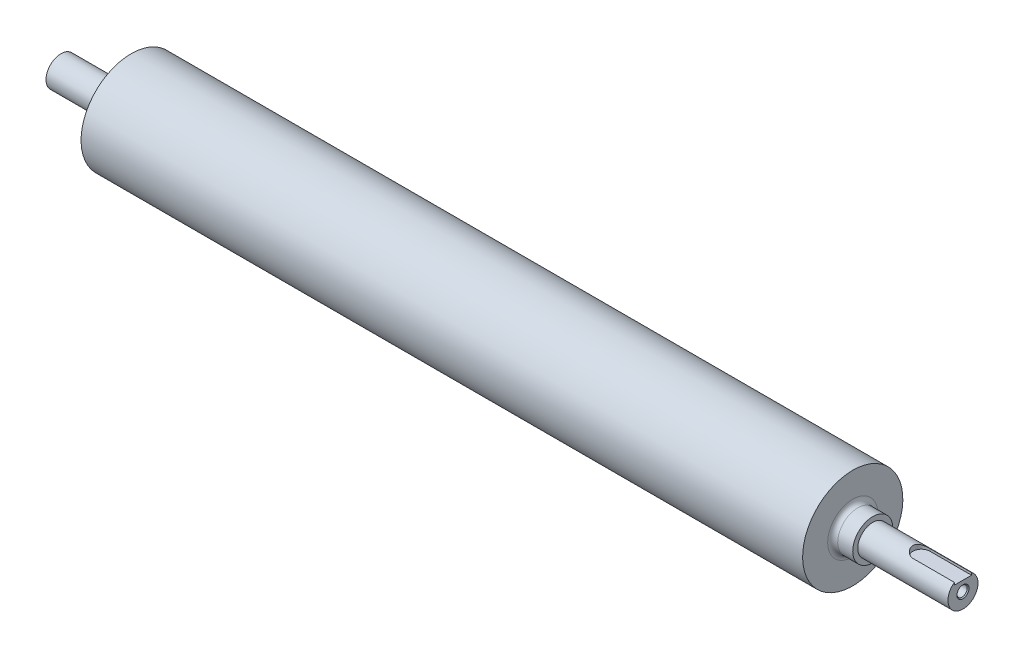
from build123d import *

# Parameters (mm, degrees)
FILLET1_R                              = 5
M12_TAPPED_HOLE1_D                     = 10.2
M12_TAPPED_HOLE1_DEPTH                 = 29.25
M12_TAPPED_HOLE1_CSINK_D               = 12.05
M12_TAPPED_HOLE1_CSINK_ANGLE           = 90
M12_TAPPED_HOLE1_TIP                   = 3.064389157
M12_TAPPED_HOLE1_ON_FACE_2_D           = 10.2
M12_TAPPED_HOLE1_ON_FACE_2_DEPTH       = 29.25
M12_TAPPED_HOLE1_ON_FACE_2_CSINK_D     = 12.05
M12_TAPPED_HOLE1_ON_FACE_2_CSINK_ANGLE = 90
M12_TAPPED_HOLE1_ON_FACE_2_TIP         = 3.064389157
CUT_EXTRUDE1_DEPTH                     = 5


with BuildPart() as part:
    # Sketch1 → Revolve1 (revolve)
    with BuildSketch(Plane.XY):
        Polygon((0, 0), (0, 15), (50, 15), (50, 20), (70, 20), (70, 50), (790, 50), (790, 20), (810, 20), (810, 15), (900, 15), (900, 0), align=None)
    revolve(axis=Axis((900, 0, 0), (-1, 0, 0)))

    # Fillet1
    fillet1_edges = [part.edges().sort_by_distance(p)[0] for p in [
        (790, -20, 0),
        (70, -20, 0),
    ]]
    fillet(fillet1_edges, radius=FILLET1_R)

    # M12 Tapped Hole1
    with Locations(Plane.YZ.offset(900)):
        with Locations((0, 0)):
            CounterSinkHole(M12_TAPPED_HOLE1_D / 2, M12_TAPPED_HOLE1_CSINK_D / 2, depth=M12_TAPPED_HOLE1_DEPTH, counter_sink_angle=M12_TAPPED_HOLE1_CSINK_ANGLE)
            with Locations((0, 0, -(M12_TAPPED_HOLE1_DEPTH + M12_TAPPED_HOLE1_TIP / 2))):  # 118° drill point
                Cone(0, M12_TAPPED_HOLE1_D / 2, M12_TAPPED_HOLE1_TIP, mode=Mode.SUBTRACT)

    # M12 Tapped Hole1 on face 2
    with Locations(Plane(origin=(0, 0, 0), x_dir=(0, 0, -1), z_dir=(-1, 0, 0))):
        with Locations((0, 0)):
            CounterSinkHole(M12_TAPPED_HOLE1_ON_FACE_2_D / 2, M12_TAPPED_HOLE1_ON_FACE_2_CSINK_D / 2, depth=M12_TAPPED_HOLE1_ON_FACE_2_DEPTH, counter_sink_angle=M12_TAPPED_HOLE1_ON_FACE_2_CSINK_ANGLE)
            with Locations((0, 0, -(M12_TAPPED_HOLE1_ON_FACE_2_DEPTH + M12_TAPPED_HOLE1_ON_FACE_2_TIP / 2))):  # 118° drill point
                Cone(0, M12_TAPPED_HOLE1_ON_FACE_2_D / 2, M12_TAPPED_HOLE1_ON_FACE_2_TIP, mode=Mode.SUBTRACT)

    # Sketch3 → Cut-Extrude1 (cut)
    with BuildSketch(Plane(origin=(0, 15, 0), x_dir=(1, 0, 0), z_dir=(0, 1, 0))):
        with BuildLine():
            Line((858.516691337, 8.516691337), (900, 8.516691337))
            ThreePointArc((900, 8.516691337), (908.516691337, 0), (900, -8.516691337))
            Line((900, -8.516691337), (858.516691337, -8.516691337))
            ThreePointArc((858.516691337, -8.516691337), (850, 0), (858.516691337, 8.516691337))
        make_face()
    extrude(amount=-CUT_EXTRUDE1_DEPTH, mode=Mode.SUBTRACT)


solid = part.part
